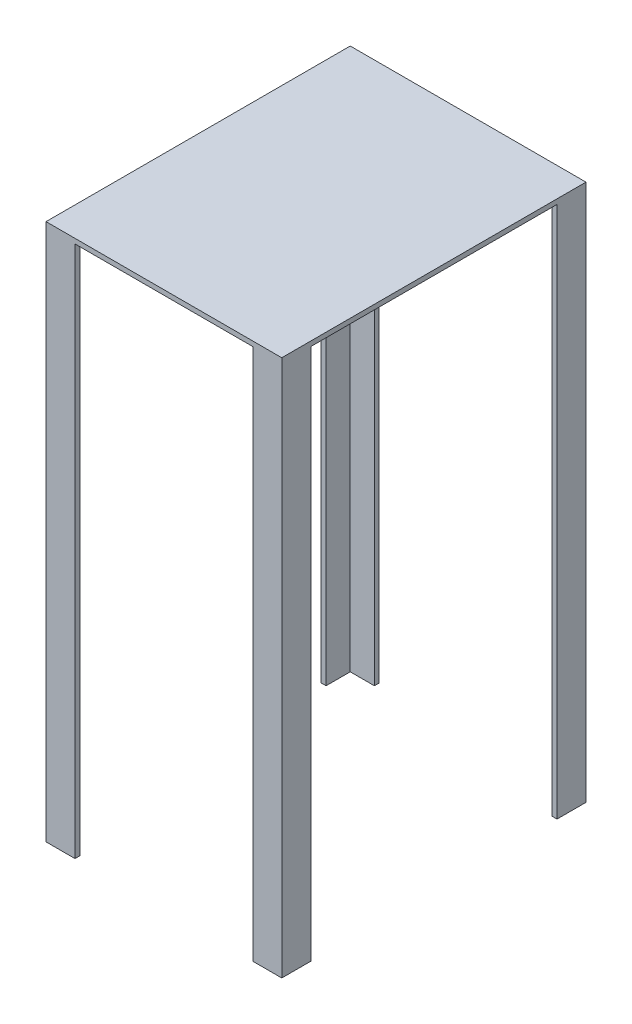
from build123d import *

# Parameters (mm, degrees)
CROQUIS2_W              = 310
CROQUIS2_H              = 400
SALIENTE_EXTRUIR1_DEPTH = 6.35
SALIENTE_EXTRUIR2_DEPTH = 700


with BuildPart() as part:
    # Croquis2 → Saliente-Extruir1 (new body)
    with BuildSketch(Plane(origin=(0, 0, 0), x_dir=(1, 0, 0), z_dir=(0, 1, 0))):
        with Locations((155, 200)):
            Rectangle(CROQUIS2_W, CROQUIS2_H)
    extrude(amount=-SALIENTE_EXTRUIR1_DEPTH)

    # Croquis3 → Saliente-Extruir2 (add)
    with BuildSketch(Plane.XZ.offset(6.35)):
        Polygon((0, 0), (38.1, 0), (38.1, -6.35), (6.35, -6.35), (6.35, -38.1), (0, -38.1), align=None)
        Polygon((303.65, -38.1), (310, -38.1), (310, 0), (271.9, 0), (271.9, -6.35), (303.65, -6.35), align=None)
        Polygon((310, -400), (271.9, -400), (271.9, -393.65), (303.65, -393.65), (303.65, -361.9), (310, -361.9), align=None)
        Polygon((6.35, -361.9), (0, -361.9), (0, -400), (38.1, -400), (38.1, -393.65), (6.35, -393.65), align=None)
    extrude(amount=SALIENTE_EXTRUIR2_DEPTH)


solid = part.part
